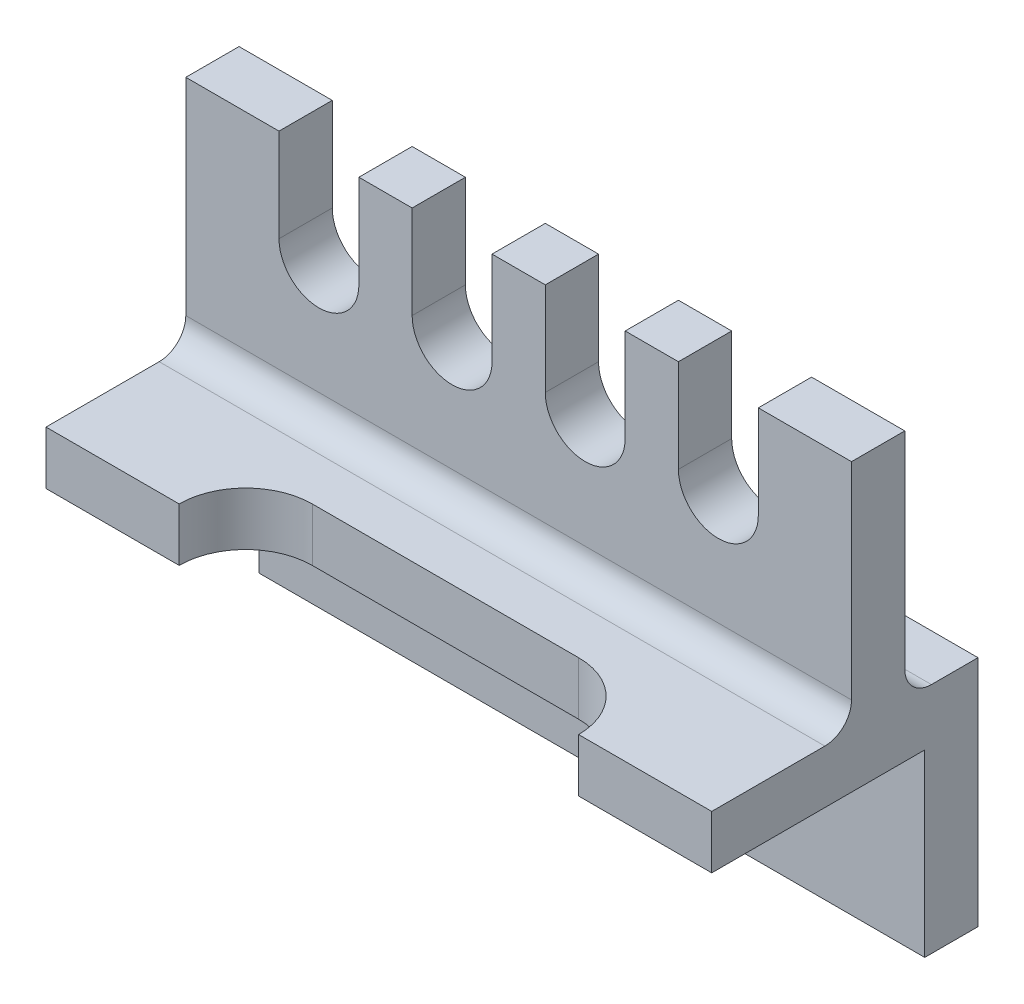
from build123d import *

# Parameters (mm, degrees)
BOSS_EXTRUDE2_DEPTH = 100
CUT_EXTRUDE1_REACH  = 125.859
CUT_EXTRUDE2_REACH  = 115.248


with BuildPart() as part:
    # Sketch1 → Boss-Extrude2 (new body)
    with BuildSketch(Plane(origin=(0, 0, 0), x_dir=(0, 0, -1), z_dir=(1, 0, 0))):
        with BuildLine():
            Line((-19, 70), (-11, 70))
            Line((-11, 70), (-11, 39))
            ThreePointArc((-11, 39), (-9.828427125, 36.171572875), (-7, 35))
            Line((-7, 35), (0, 35))
            Line((0, 35), (0, 0))
            Line((0, 0), (-8, 0))
            Line((-8, 0), (-8, 27))
            Line((-8, 27), (-40, 27))
            Line((-40, 27), (-40, 35))
            Line((-40, 35), (-23, 35))
            ThreePointArc((-23, 35), (-20.171572875, 36.171572875), (-19, 39))
            Line((-19, 39), (-19, 70))
        make_face()
    extrude(amount=BOSS_EXTRUDE2_DEPTH)

    # Sketch2 → Cut-Extrude1 (cut, up to next)
    with BuildSketch(Plane.XY.offset(19), mode=Mode.PRIVATE) as cut_extrude1_sk1:
        with BuildLine():
            Line((14, 56), (14, 70))
            Line((14, 70), (26, 70))
            Line((26, 70), (26, 56))
            ThreePointArc((26, 56), (20, 50), (14, 56))
        make_face()
    cut_extrude1_tool1 = extrude(cut_extrude1_sk1.sketch, amount=-CUT_EXTRUDE1_REACH, mode=Mode.PRIVATE) & part.part
    # Sketch2 → Cut-Extrude1 (cut, up to next)
    with BuildSketch(Plane.XY.offset(19), mode=Mode.PRIVATE) as cut_extrude1_sk2:
        with BuildLine():
            Line((34, 56), (34, 70))
            Line((34, 70), (46, 70))
            Line((46, 70), (46, 56))
            ThreePointArc((46, 56), (40, 50), (34, 56))
        make_face()
    cut_extrude1_tool2 = extrude(cut_extrude1_sk2.sketch, amount=-CUT_EXTRUDE1_REACH, mode=Mode.PRIVATE) & part.part
    # Sketch2 → Cut-Extrude1 (cut, up to next)
    with BuildSketch(Plane.XY.offset(19), mode=Mode.PRIVATE) as cut_extrude1_sk3:
        with BuildLine():
            Line((54, 56), (54, 70))
            Line((54, 70), (66, 70))
            Line((66, 70), (66, 56))
            ThreePointArc((66, 56), (60, 50), (54, 56))
        make_face()
    cut_extrude1_tool3 = extrude(cut_extrude1_sk3.sketch, amount=-CUT_EXTRUDE1_REACH, mode=Mode.PRIVATE) & part.part
    # Sketch2 → Cut-Extrude1 (cut, up to next)
    with BuildSketch(Plane.XY.offset(19), mode=Mode.PRIVATE) as cut_extrude1_sk4:
        with BuildLine():
            Line((74, 56), (74, 70))
            Line((74, 70), (86, 70))
            Line((86, 70), (86, 56))
            ThreePointArc((86, 56), (80, 50), (74, 56))
        make_face()
    cut_extrude1_tool4 = extrude(cut_extrude1_sk4.sketch, amount=-CUT_EXTRUDE1_REACH, mode=Mode.PRIVATE) & part.part
    add(cut_extrude1_tool1.solids().sort_by_distance((20, 60.595886, 19))[0], mode=Mode.SUBTRACT)
    add(cut_extrude1_tool2.solids().sort_by_distance((40, 60.595886, 19))[0], mode=Mode.SUBTRACT)
    add(cut_extrude1_tool3.solids().sort_by_distance((60, 60.595886, 19))[0], mode=Mode.SUBTRACT)
    add(cut_extrude1_tool4.solids().sort_by_distance((80, 60.595886, 19))[0], mode=Mode.SUBTRACT)

    # Sketch3 → Cut-Extrude2 (cut, up to next)
    with BuildSketch(Plane(origin=(0, 35, 0), x_dir=(1, 0, 0), z_dir=(0, 1, 0)), mode=Mode.PRIVATE) as cut_extrude2_sk1:
        with BuildLine():
            Line((20, -40), (80, -40))
            ThreePointArc((80, -40), (77.071067812, -32.928932188), (70, -30))
            Line((70, -30), (30, -30))
            ThreePointArc((30, -30), (22.928932188, -32.928932188), (20, -40))
        make_face()
    cut_extrude2_tool1 = extrude(cut_extrude2_sk1.sketch, amount=-CUT_EXTRUDE2_REACH, mode=Mode.PRIVATE) & part.part
    add(cut_extrude2_tool1.solids().sort_by_distance((50, 35, 35.213132))[0], mode=Mode.SUBTRACT)


solid = part.part
